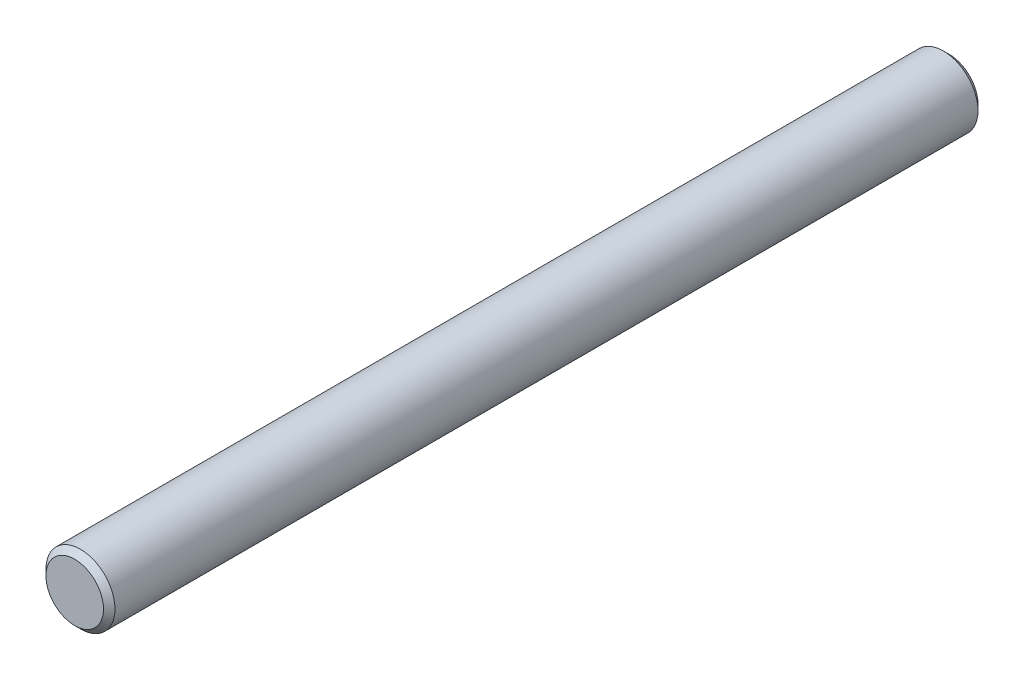
from build123d import *

# Parameters (mm, degrees)
SCHIZZO1_R                   = 1.5
ESTRUSIONE_ESTRUSIONE1_DEPTH = 38
SMUSSO1_SIZE                 = 0.25


with BuildPart() as part:
    # Schizzo1 → Estrusione-Estrusione1 (new body)
    with BuildSketch(Plane.XY):
        Circle(SCHIZZO1_R)
    extrude(amount=ESTRUSIONE_ESTRUSIONE1_DEPTH)

    # Smusso1
    smusso1_edges = [part.edges().sort_by_distance(p)[0] for p in [
        (-1.5, 0, 0),
        (-1.5, 0, 38),
    ]]
    chamfer(smusso1_edges, length=SMUSSO1_SIZE)


solid = part.part
